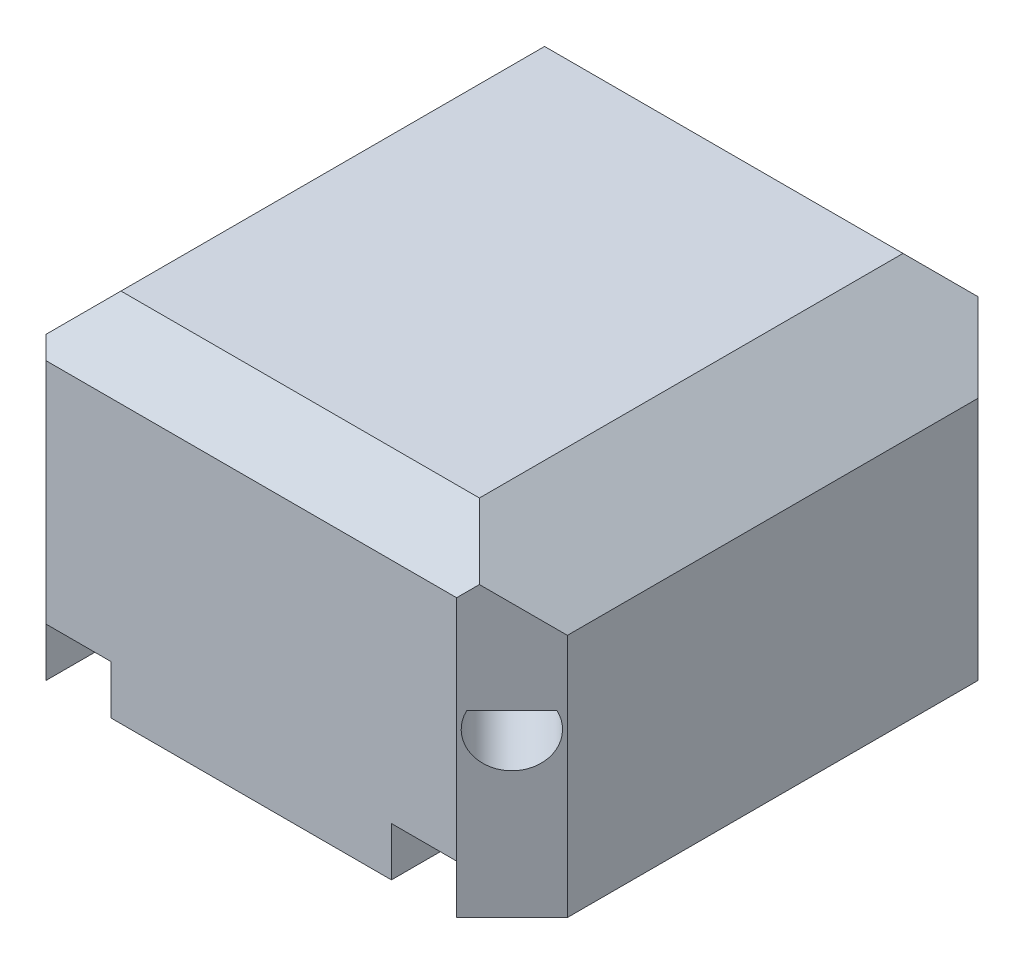
from build123d import *

# Parameters (mm, degrees)
SKETCH1_W                                = 160
SKETCH1_H                                = 160
BOSS_EXTRUDE1_DEPTH                      = 100
CHAMFER1_SIZE                            = 25
CHAMFER2_SIZE                            = 17
CHAMFER3_SIZE                            = 15
CUT_EXTRUDE1_DEPTH                       = 50
SKETCH3_W                                = 20
SKETCH3_H                                = 160
CUT_EXTRUDE2_DEPTH                       = 15
MIRROR1_AT_THE_SECOND_PLANE_COPY_1_DEPTH = 50


with BuildPart() as part:
    # Sketch1 → Boss-Extrude1 (new body)
    with BuildSketch(Plane(origin=(0, 0, 0), x_dir=(1, 0, 0), z_dir=(0, 1, 0))):
        with Locations((-95.343060511, -3.92868134)):
            Rectangle(SKETCH1_W, SKETCH1_H)
    extrude(amount=BOSS_EXTRUDE1_DEPTH)

    # Chamfer1
    chamfer1_edges = [part.edges().sort_by_distance(p)[0] for p in [
        (-15.343060511, 100, 3.92868134),
        (-175.343060511, 100, 3.92868134),
    ]]
    chamfer(chamfer1_edges, length=CHAMFER1_SIZE)

    # Chamfer2
    chamfer2_edges = [part.edges().sort_by_distance(p)[0] for p in [
        (-15.343060511, 37.5, 83.92868134),
        (-175.343060511, 37.5, 83.92868134),
        (-175.343060511, 37.5, -76.07131866),
        (-15.343060511, 37.5, -76.07131866),
    ]]
    chamfer(chamfer2_edges, length=CHAMFER2_SIZE)

    # Chamfer3
    chamfer3_edges = [part.edges().sort_by_distance(p)[0] for p in [
        (-95.343060511, 100, 83.92868134),
        (-95.343060511, 100, -76.07131866),
    ]]
    chamfer(chamfer3_edges, length=CHAMFER3_SIZE)

    # Sketch2 → Cut-Extrude1 (cut)
    with BuildSketch(Plane(origin=(21.864129074, 0, -21.864129074), x_dir=(-0.7071067811865471, 0, -0.7071067811865479), z_dir=(0.7071067811865479, 0, -0.7071067811865471))):
        with BuildLine():
            ThreePointArc((75.669890857, 50), (75.36515964, 52.571230378), (74.467849828, 55))
            Line((74.467849828, 55), (64.669890857, 55))
            Line((64.669890857, 55), (54.871931886, 55))
            ThreePointArc((54.871931886, 55), (62.098660479, 39.304731217), (75.669890857, 50))
        make_face()
    cut_extrude1 = extrude(amount=-CUT_EXTRUDE1_DEPTH, mode=Mode.SUBTRACT)

    # Sketch3 → Cut-Extrude2 (cut)
    with BuildSketch(Plane.XZ):
        with Locations((-148.343060511, 3.92868134)):
            Rectangle(SKETCH3_W, SKETCH3_H)
        with Locations((-42.343060511, 3.92868134)):
            Rectangle(SKETCH3_W, SKETCH3_H)
    extrude(amount=-CUT_EXTRUDE2_DEPTH, mode=Mode.SUBTRACT)

    # Mirror1: Cut-Extrude1 across plane
    add(cut_extrude1.mirror(Plane(origin=(0, 0, 3.92868134), x_dir=(1, 0, 0), z_dir=(0, 0, -1))), mode=Mode.SUBTRACT)

    # Mirror1 at the second plane: Cut-Extrude1 across plane
    add(cut_extrude1.mirror(Plane.ZY.offset(95.343060511)), mode=Mode.SUBTRACT)

    # Mirror1 at the second plane copy 1 sketc → Mirror1 at the second plane copy 1 (cut)
    with BuildSketch(Plane(origin=(-212.550250097, 0, 29.721491754), x_dir=(0.7071067811865474, 0, 0.7071067811865477), z_dir=(-0.7071067811865477, 0, 0.7071067811865474))):
        with BuildLine():
            ThreePointArc((75.669890857, 50), (75.36515964, 52.571230378), (74.467849828, 55))
            Line((74.467849828, 55), (64.669890857, 55))
            Line((64.669890857, 55), (54.871931886, 55))
            ThreePointArc((54.871931886, 55), (62.098660479, 39.304731217), (75.669890857, 50))
        make_face()
    extrude(amount=-MIRROR1_AT_THE_SECOND_PLANE_COPY_1_DEPTH, mode=Mode.SUBTRACT)


solid = part.part
